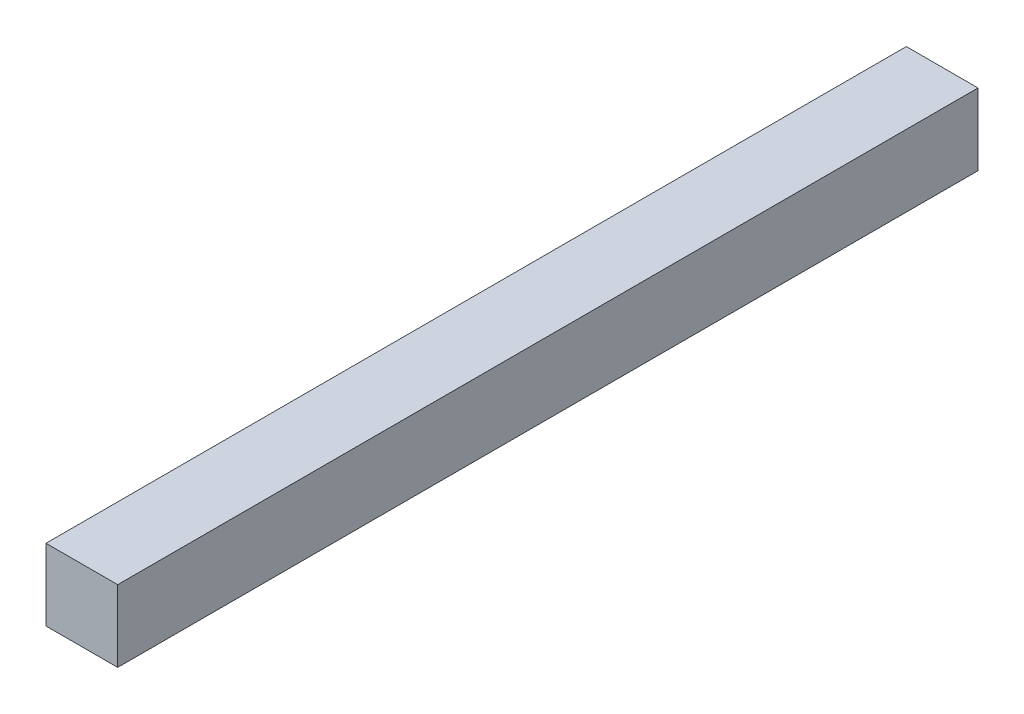
from build123d import *

# Parameters (mm, degrees)
SKETCH1_W           = 5
SKETCH1_H           = 5
BOSS_EXTRUDE1_DEPTH = 60


with BuildPart() as part:
    # Sketch1 → Boss-Extrude1 (new body)
    with BuildSketch(Plane.XY):
        Rectangle(SKETCH1_W, SKETCH1_H)
    extrude(amount=BOSS_EXTRUDE1_DEPTH)


solid = part.part
